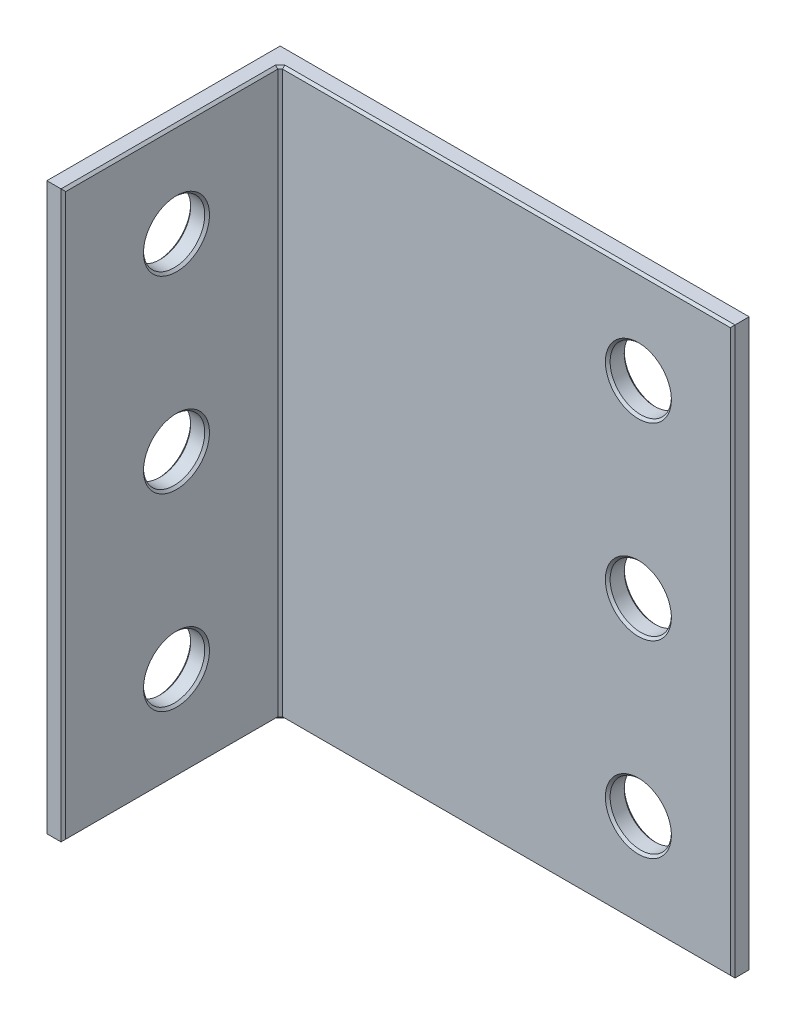
from build123d import *

# Parameters (mm, degrees)
SKETCH_1_W          = 200
SKETCH_1_H          = 240
SKETCH_1_R          = 13
EXTRUDE_379_DEPTH   = 8
SKETCH_2_W          = 8
SKETCH_2_H          = 240
EXTRUDE_1_DEPTH     = 92
SKETCH_3_R          = 13
CUT_EXTRUDE_1_DEPTH = 329.024389337
CHAMFER_1_SIZE      = 1


with BuildPart() as part:
    # 草图1 → Extrude 379 (new body)
    with BuildSketch(Plane.XY):
        with Locations((100, 120)):
            Rectangle(SKETCH_1_W, SKETCH_1_H)
        with Locations((160, 40)):
            Circle(SKETCH_1_R, mode=Mode.SUBTRACT)
        with Locations((160, 120)):
            Circle(SKETCH_1_R, mode=Mode.SUBTRACT)
        with Locations((160, 200)):
            Circle(SKETCH_1_R, mode=Mode.SUBTRACT)
    extrude(amount=EXTRUDE_379_DEPTH)

    # 草图2 → 凸台-拉伸1 (add)
    with BuildSketch(Plane.XY.offset(8)):
        with Locations((4, 120)):
            Rectangle(SKETCH_2_W, SKETCH_2_H)
    extrude(amount=EXTRUDE_1_DEPTH)

    # 草图3 → 切除-拉伸1 (cut, through all)
    with BuildSketch(Plane.ZY):
        with Locations((52, 200)):
            Circle(SKETCH_3_R)
        with Locations((52, 120)):
            Circle(SKETCH_3_R)
        with Locations((52, 40)):
            Circle(SKETCH_3_R)
    extrude(amount=-CUT_EXTRUDE_1_DEPTH, mode=Mode.SUBTRACT)

    # 倒角1
    chamfer_1_edges = [part.edges().sort_by_distance(p)[0] for p in [
        (200, 120, 8),
        (147, 40, 0),
        (147, 40, 8),
        (104, 240, 8),
        (147, 120, 0),
        (147, 120, 8),
        (147, 200, 0),
        (147, 200, 8),
        (104, 0, 8),
        (8, 120, 8),
        (8, 0, 54),
        (8, 240, 54),
        (0, 120, 100),
        (8, 120, 100),
        (8, 200, 39),
        (0, 200, 39),
        (100, 240, 0),
        (8, 120, 39),
        (0, 120, 39),
        (200, 120, 0),
        (8, 40, 39),
        (0, 40, 39),
        (100, 0, 0),
        (0, 120, 0),
        (0, 240, 50),
        (0, 0, 50),
    ]]
    chamfer(chamfer_1_edges, length=CHAMFER_1_SIZE)


solid = part.part
